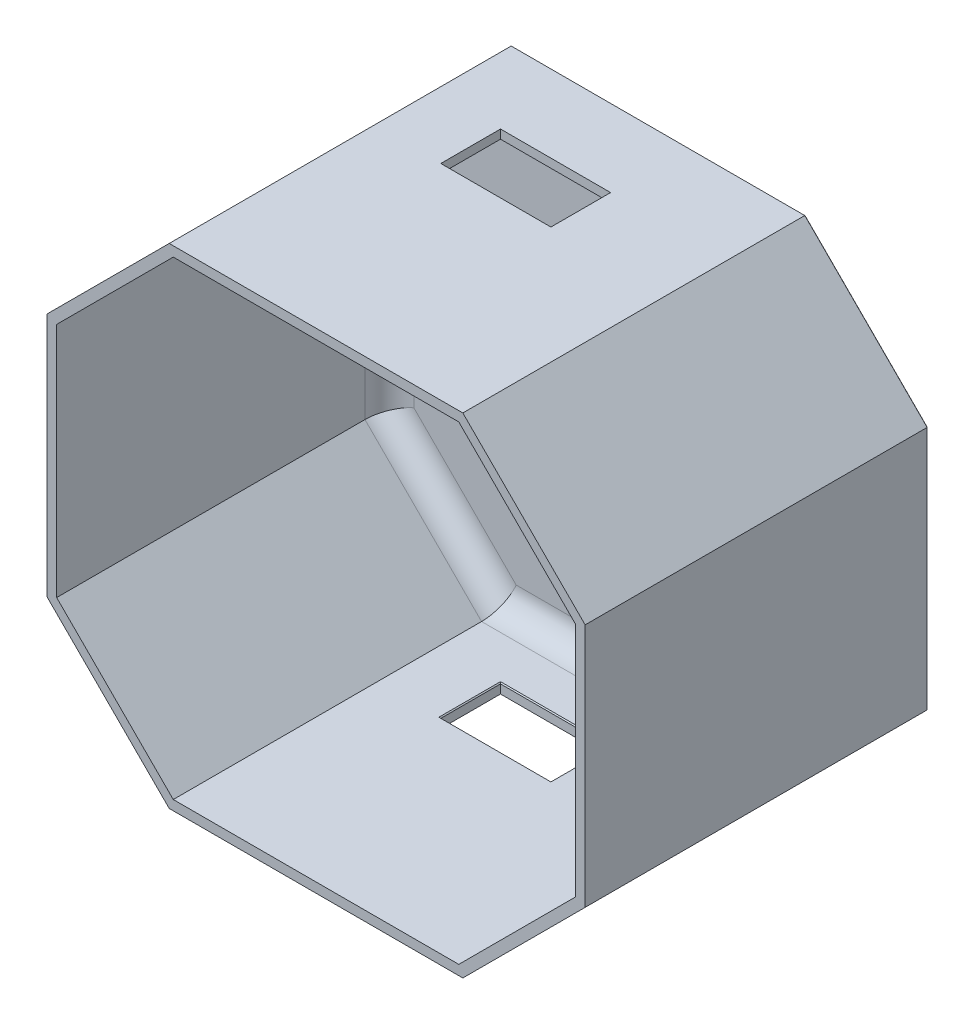
from build123d import *

# Parameters (mm, degrees)
SALIENTE_EXTRUIR1_DEPTH = 70
VACIADO1_T              = -2
CORTAR_EXTRUIR1_REACH   = 135.884
CROQUIS4_W              = 22.5
CROQUIS4_H              = 12.2
REDONDEO1_R             = 5
CHAFL_N1_SIZE           = 0.12
CHAFL_N2_SIZE           = 0.2


with BuildPart() as part:
    # Croquis1 → Saliente-Extruir1 (new body)
    with BuildSketch(Plane.XY):
        Polygon((30, 50), (-30, 50), (-55, 25), (-55, -25), (-30, -50), (30, -50), (55, -25), (55, 25), align=None)
    extrude(amount=SALIENTE_EXTRUIR1_DEPTH)

    # Vaciado1
    vaciado1_openings = [part.faces().sort_by_distance(p)[0] for p in [
        (0, 0, 70),
    ]]
    offset(amount=VACIADO1_T, openings=vaciado1_openings, kind=Kind.INTERSECTION)

    # Croquis4 → Cortar-Extruir1 (cut, up to next)
    with BuildSketch(Plane.XZ.offset(50), mode=Mode.PRIVATE) as cortar_extruir1_sk1:
        with Locations((-5.15, 22)):
            Rectangle(CROQUIS4_W, CROQUIS4_H)
    cortar_extruir1_tool1 = extrude(cortar_extruir1_sk1.sketch, amount=-CORTAR_EXTRUIR1_REACH, mode=Mode.PRIVATE) & part.part
    cortar_extruir1 = cortar_extruir1_tool1.solids().sort_by_distance((-5.15, -50, 22))[0]
    add(cortar_extruir1, mode=Mode.SUBTRACT)

    # Simetría1: Cortar-Extruir1 across plane
    add(cortar_extruir1.mirror(Plane.ZX), mode=Mode.SUBTRACT)

    # Redondeo1
    redondeo1_edges = [part.edges().sort_by_distance(p)[0] for p in [
        (41.085786438, -36.085786438, 2),
        (53, 0, 2),
        (41.085786438, 36.085786438, 2),
        (0, 48, 2),
        (-41.085786438, 36.085786438, 2),
        (-53, 0, 2),
        (-41.085786438, -36.085786438, 2),
        (0, -48, 2),
    ]]
    fillet(redondeo1_edges, radius=REDONDEO1_R)

    # Chaflán1
    chafl_n1_edges = [part.edges().sort_by_distance(p)[0] for p in [
        (0, 50, 0),
        (42.5, 37.5, 0),
        (55, 0, 0),
        (42.5, -37.5, 0),
        (0, -50, 0),
        (-42.5, -37.5, 0),
        (-55, 0, 0),
        (-42.5, 37.5, 0),
    ]]
    chamfer(chafl_n1_edges, length=CHAFL_N1_SIZE)

    # Chaflán2
    chafl_n2_edges = [part.edges().sort_by_distance(p)[0] for p in [
        (-5.15, -48, 15.9),
        (6.1, -48, 22),
        (-5.15, -48, 28.1),
        (-16.4, -48, 22),
        (-5.15, 48, 28.1),
        (-16.4, 48, 22),
        (-5.15, 48, 15.9),
        (6.1, 48, 22),
    ]]
    chamfer(chafl_n2_edges, length=CHAFL_N2_SIZE)


solid = part.part
